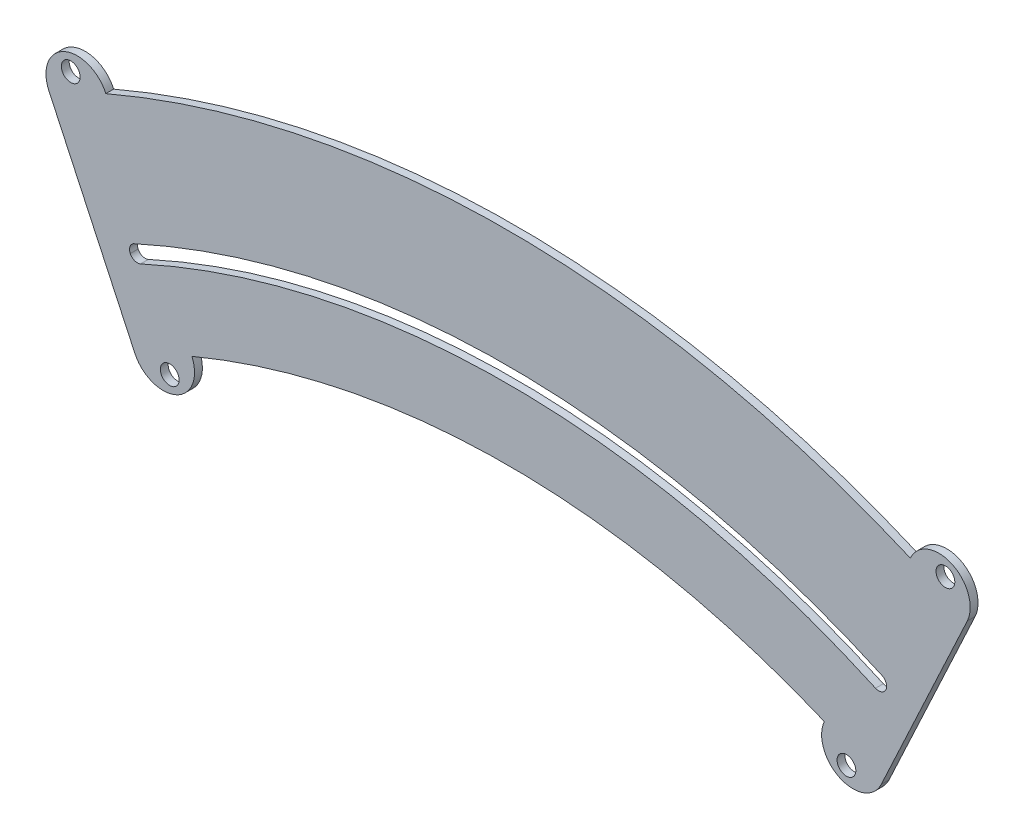
from build123d import *

# Parameters (mm, degrees)
DODANIE_WYCI_GNI_CIE1_DEPTH = 5
DODANIE_WYCI_GNI_CIE2_START = -5
SZKIC2_R                    = 6
DODANIE_WYCI_GNI_CIE2_DEPTH = 5
WYTNIJ_WYCI_GNI_CIE1_DEPTH  = 716.158788588


with BuildPart() as part:
    # Szkic1 → Dodanie-wyciągnięcie1 (new body)
    with BuildSketch(Plane.XY):
        with BuildLine():
            ThreePointArc((-241.458717663, 517.809891046), (0, 571.34), (241.458717663, 517.809891046))
            Line((241.458717663, 517.809891046), (275.268178602, 590.314514008))
            ThreePointArc((275.268178602, 590.314514008), (0, 651.34), (-275.268178602, 590.314514008))
            Line((-275.268178602, 590.314514008), (-241.458717663, 517.809891046))
        make_face()
        with BuildLine():
            ThreePointArc((-220.327804576, 472.494501694), (0, 521.34), (220.327804576, 472.494501694))
            Line((220.327804576, 472.494501694), (241.458717663, 517.809891046))
            ThreePointArc((241.458717663, 517.809891046), (0, 571.34), (-241.458717663, 517.809891046))
            Line((-241.458717663, 517.809891046), (-220.327804576, 472.494501694))
        make_face()
    extrude(amount=DODANIE_WYCI_GNI_CIE1_DEPTH)

    # Szkic2 → Dodanie-wyciągnięcie2 (add)
    with BuildSketch(Plane.XY.offset(5).offset(DODANIE_WYCI_GNI_CIE2_START)):
        with BuildLine():
            Line((-293.394334343, 581.862148774), (-238.453960317, 464.042136459))
            ThreePointArc((-238.453960317, 464.042136459), (-212.049678092, 454.288112103), (-202.042855969, 480.597627909))
            ThreePointArc((-202.042855969, 480.597627909), (0, 521.34), (202.042855969, 480.597627909))
            ThreePointArc((202.042855969, 480.597627909), (212.049678092, 454.288112103), (238.453960317, 464.042136459))
            Line((238.453960317, 464.042136459), (293.394334343, 581.862148774))
            ThreePointArc((293.394334343, 581.862148774), (283.581145562, 608.505021982), (257.014390413, 598.487592788))
            ThreePointArc((257.014390413, 598.487592788), (0, 651.34), (-257.014390413, 598.487592788))
            ThreePointArc((-257.014390413, 598.487592788), (-283.581145562, 608.505021982), (-293.394334343, 581.862148774))
        make_face()
        with Locations((-279.424662082, 599.409767995)):
            Circle(SZKIC2_R, mode=Mode.SUBTRACT)
        with Locations((-216.188741334, 463.391306898)):
            Circle(SZKIC2_R, mode=Mode.SUBTRACT)
        with Locations((216.188741334, 463.391306898)):
            Circle(SZKIC2_R, mode=Mode.SUBTRACT)
        with Locations((279.424662082, 599.409767995)):
            Circle(SZKIC2_R, mode=Mode.SUBTRACT)
    extrude(amount=DODANIE_WYCI_GNI_CIE2_DEPTH)

    # Szkic4 → Wytnij-wyciągnięcie1 (cut, through all)
    with BuildSketch(Plane.XY.offset(5)):
        with BuildLine():
            ThreePointArc((234.78479941, 515.380532778), (238.578545987, 515.23612037), (241.380121814, 517.798256378))
            Line((241.380121814, 517.798256378), (241.398609626, 517.837915637))
            ThreePointArc((241.398609626, 517.837915637), (241.544560472, 521.672077329), (238.930450422, 524.480729352))
            ThreePointArc((238.930450422, 524.480729352), (0, 576.34), (-238.930450422, 524.480729352))
            ThreePointArc((-238.930450422, 524.480729352), (-241.544560472, 521.672077329), (-241.398609626, 517.837915637))
            Line((-241.398609626, 517.837915637), (-241.380121814, 517.798256378))
            ThreePointArc((-241.380121814, 517.798256378), (-238.578545987, 515.23612037), (-234.78479941, 515.380532778))
            ThreePointArc((-234.78479941, 515.380532778), (0, 566.34), (234.78479941, 515.380532778))
        make_face()
    extrude(amount=-WYTNIJ_WYCI_GNI_CIE1_DEPTH, mode=Mode.SUBTRACT)


solid = part.part
